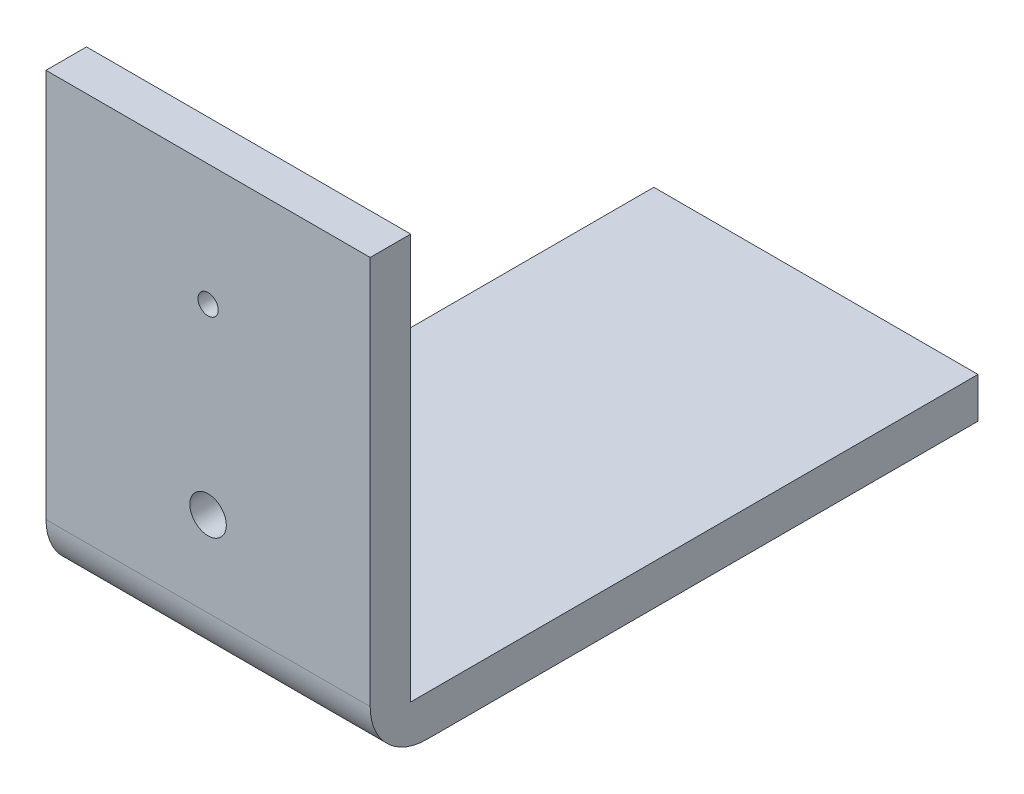
from build123d import *

# Parameters (mm, degrees)
CROQUIS1_W              = 40
CROQUIS1_H              = 50
SALIENTE_EXTRUIR1_DEPTH = 5
CROQUIS2_R              = 1.25
CROQUIS2_R_2            = 2.25
CORTAR_EXTRUIR2_DEPTH   = 5
CROQUIS4_W              = 40
CROQUIS4_H              = 75
SALIENTE_EXTRUIR2_DEPTH = 5
REDONDEO1_R             = 7


with BuildPart() as part:
    # Croquis1 → Saliente-Extruir1 (new body)
    with BuildSketch(Plane.XY):
        with Locations((4.439140811, -9.15274463)):
            Rectangle(CROQUIS1_W, CROQUIS1_H)
    extrude(amount=SALIENTE_EXTRUIR1_DEPTH)

    # Croquis2 → Cortar-Extruir2 (cut)
    with BuildSketch(Plane.XY.offset(5)):
        with Locations((4.439140811, 0.84725537)):
            Circle(CROQUIS2_R)
        with Locations((4.439140811, -21.65274463)):
            Circle(CROQUIS2_R_2)
    extrude(amount=-CORTAR_EXTRUIR2_DEPTH, mode=Mode.SUBTRACT)

    # Croquis4 → Saliente-Extruir2 (add)
    with BuildSketch(Plane.XZ.offset(34.15274463)):
        with Locations((4.439140811, -32.5)):
            Rectangle(CROQUIS4_W, CROQUIS4_H)
    extrude(amount=SALIENTE_EXTRUIR2_DEPTH)

    # Redondeo1
    redondeo1_edges = [part.edges().sort_by_distance(p)[0] for p in [
        (4.439140811, -39.15274463, 5),
    ]]
    fillet(redondeo1_edges, radius=REDONDEO1_R)


solid = part.part
